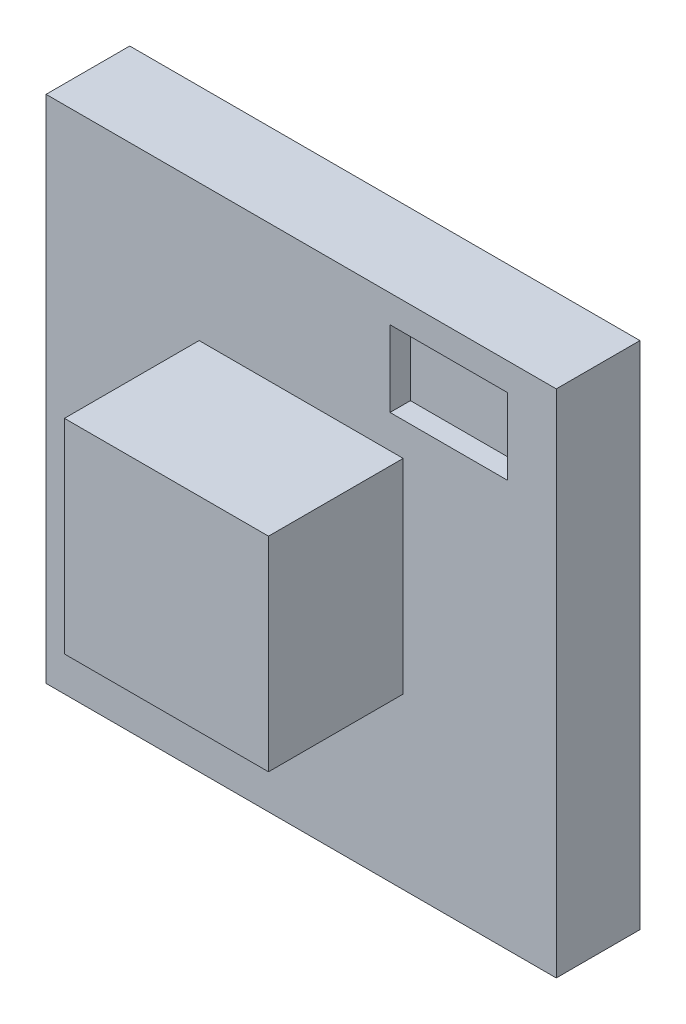
from build123d import *

# Parameters (mm, degrees)
SKETCH_1_W          = 25
SKETCH_1_H          = 25
EXTRUDE_1_DEPTH     = 4.1
SKETCH_2_W          = 10
SKETCH_2_H          = 10
EXTRUDE_2_DEPTH     = 6.6
SKETCH_3_W          = 5.758400008
SKETCH_3_H          = 3.721892688
CUT_EXTRUDE_1_DEPTH = 1


with BuildPart() as part:
    # 草图1 → 凸台-拉伸1 (new body)
    with BuildSketch(Plane.XY):
        with Locations((-11.324496329, 9.624744468)):
            Rectangle(SKETCH_1_W, SKETCH_1_H)
    extrude(amount=EXTRUDE_1_DEPTH)

    # 草图2 → 凸台-拉伸2 (add)
    with BuildSketch(Plane.XY.offset(4.1)):
        with Locations((-11.324496329, 10.424744468)):
            Rectangle(SKETCH_2_W, SKETCH_2_H)
    extrude(amount=EXTRUDE_2_DEPTH)

    # 草图3 → 切除-拉伸1 (cut)
    with BuildSketch(Plane.XY.offset(4.1)):
        with Locations((-4.091384125, 18.91192009)):
            Rectangle(SKETCH_3_W, SKETCH_3_H)
    extrude(amount=-CUT_EXTRUDE_1_DEPTH, mode=Mode.SUBTRACT)


solid = part.part
